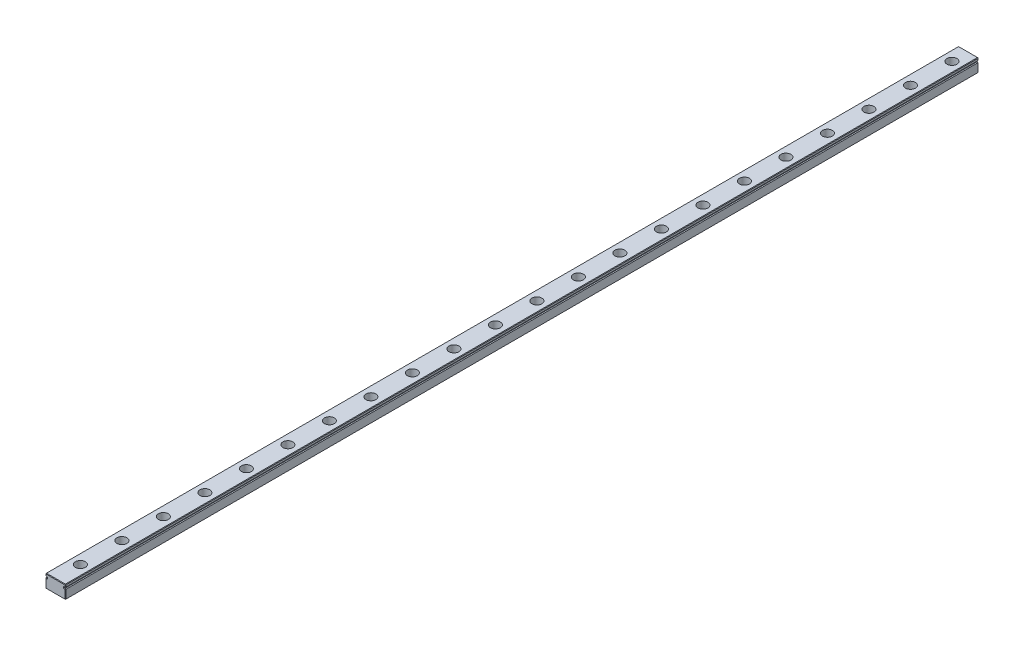
from build123d import *

# Parameters (mm, degrees)
BOSS_EXTRUDE1_DEPTH         = 550
CHAMFER1_SIZE               = 0.3
HOLE_WIZARD_M51_D           = 3.5
HOLE_WIZARD_M51_CBORE_D     = 6
HOLE_WIZARD_M51_CBORE_DEPTH = 4.5
LPATTERN1_COUNT             = 22
LPATTERN1_PITCH             = 25


with BuildPart() as part:
    # Sketch1 → Boss-Extrude1 (new body)
    with BuildSketch(Plane.XY):
        with BuildLine():
            Line((0, 8), (12, 8))
            Line((12, 8), (12, 6.75))
            Line((12, 6.75), (12, 6.559016994))
            ThreePointArc((12, 6.559016994), (11.706107374, 6.475528258), (11.5, 6.25))
            Line((11.5, 6.25), (11, 6.25))
            Line((11, 6.25), (11, 5.75))
            Line((11, 5.75), (11.5, 5.75))
            ThreePointArc((11.5, 5.75), (11.706107374, 5.524471742), (12, 5.440983006))
            Line((12, 5.440983006), (12, 5.25))
            Line((12, 5.25), (12, 0))
            Line((12, 0), (0, 0))
            Line((0, 0), (0, 5.25))
            Line((0, 5.25), (0, 5.440983006))
            ThreePointArc((0, 5.440983006), (0.293892626, 5.524471742), (0.5, 5.75))
            Line((0.5, 5.75), (1, 5.75))
            Line((1, 5.75), (1, 6.25))
            Line((1, 6.25), (0.5, 6.25))
            ThreePointArc((0.5, 6.25), (0.293892626, 6.475528258), (0, 6.559016994))
            Line((0, 6.559016994), (0, 6.75))
            Line((0, 6.75), (0, 8))
        make_face()
    extrude(amount=BOSS_EXTRUDE1_DEPTH)

    # Chamfer1
    chamfer1_edges = [part.edges().sort_by_distance(p)[0] for p in [
        (12, 2.720491503, 550),
        (11.706107374, 5.524471742, 550),
        (0, 2.720491503, 0),
        (0.293892626, 5.524471742, 0),
        (0.75, 5.75, 0),
        (1, 6, 0),
        (0.75, 6.25, 0),
        (11.25, 5.75, 550),
        (0.293892626, 6.475528258, 0),
        (0, 7.279508497, 0),
        (6, 8, 0),
        (12, 7.279508497, 0),
        (11.706107374, 6.475528258, 0),
        (11, 6, 550),
        (11.25, 6.25, 0),
        (11, 6, 0),
        (11.25, 5.75, 0),
        (11.706107374, 5.524471742, 0),
        (12, 2.720491503, 0),
        (6, 0, 0),
        (11.25, 6.25, 550),
        (11.706107374, 6.475528258, 550),
        (12, 7.279508497, 550),
        (0, 8, 275),
        (12, 8, 275),
        (12, 0, 275),
        (0, 0, 275),
        (6, 8, 550),
        (0, 2.720491503, 550),
        (0, 7.279508497, 550),
        (0.293892626, 6.475528258, 550),
        (0.75, 6.25, 550),
        (1, 6, 550),
        (0.75, 5.75, 550),
        (0.293892626, 5.524471742, 550),
        (6, 0, 550),
    ]]
    chamfer(chamfer1_edges, length=CHAMFER1_SIZE)

    # Цековка для  болта с шестигранной головкой M51 (through all)
    with Locations(Plane(origin=(6, 8, 10), x_dir=(0, 0, 1), z_dir=(0, 1, 0))):
        with Locations((0, 0)):
            hole_wizard_m51 = CounterBoreHole(HOLE_WIZARD_M51_D / 2, HOLE_WIZARD_M51_CBORE_D / 2, HOLE_WIZARD_M51_CBORE_DEPTH)

    # LPattern1: Цековка для  болта с шестигранной головкой M51 ×22
    with Locations(*[(0, 0, i * LPATTERN1_PITCH) for i in range(1, LPATTERN1_COUNT)]):
        add(hole_wizard_m51, mode=Mode.SUBTRACT)


solid = part.part
